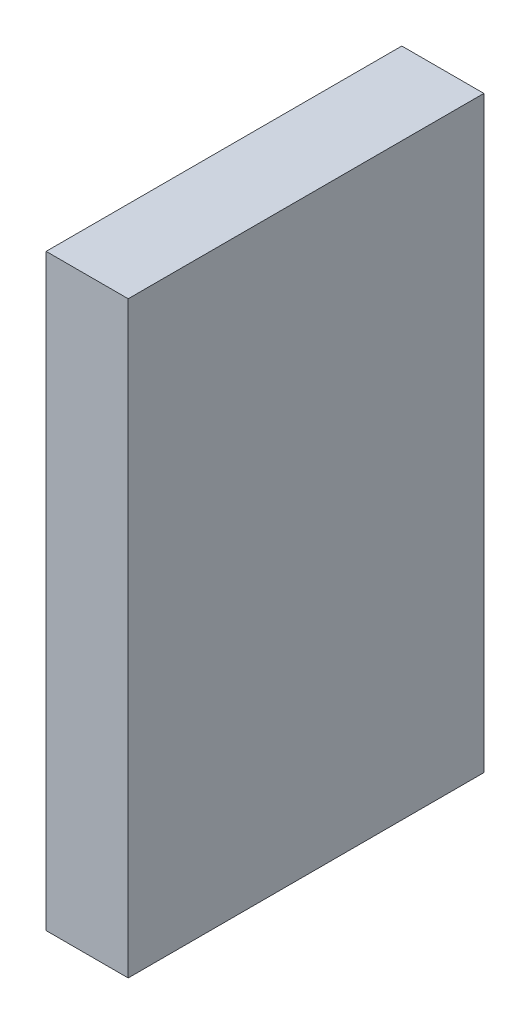
from build123d import *

# Parameters (mm, degrees)
ESBO_O1_W                = 3
ESBO_O1_H                = 13
RESSALTO_EXTRUS_O1_DEPTH = 21.5


with BuildPart() as part:
    # Esboço1 → Ressalto-extrusão1 (new body)
    with BuildSketch(Plane(origin=(0, 0, 0), x_dir=(1, 0, 0), z_dir=(0, 1, 0))):
        with Locations((1.5, 6.5)):
            Rectangle(ESBO_O1_W, ESBO_O1_H)
    extrude(amount=RESSALTO_EXTRUS_O1_DEPTH)


solid = part.part
